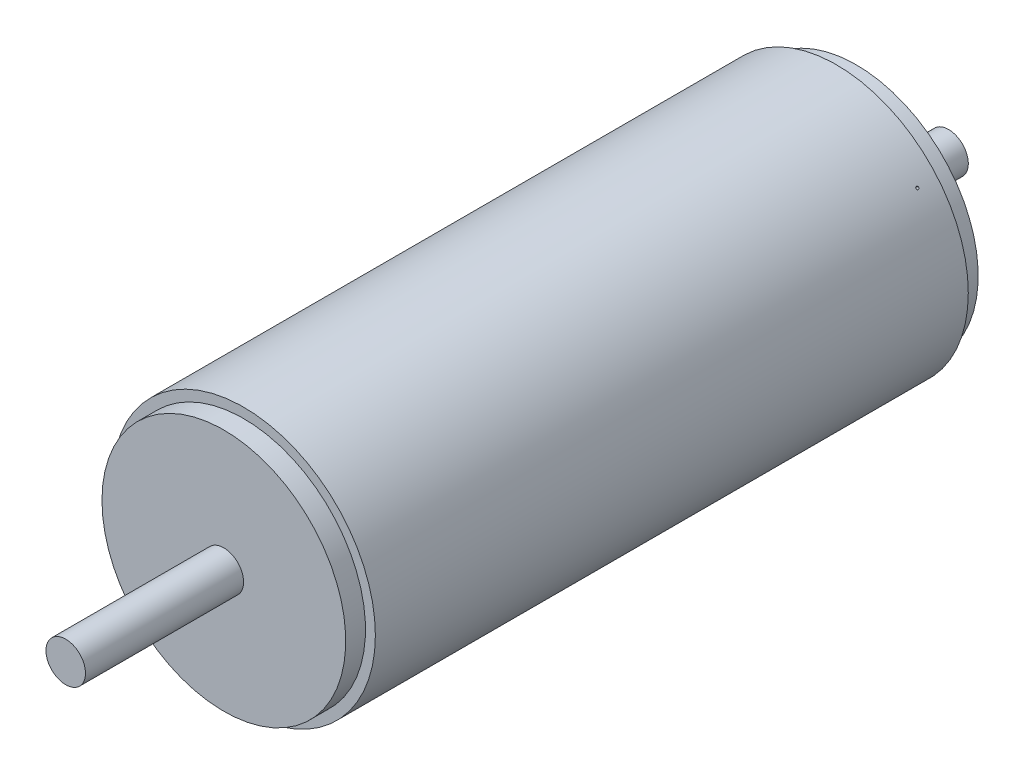
from build123d import *

# Parameters (mm, degrees)
SKETCH1_R           = 100
BOSS_EXTRUDE1_DEPTH = 450
SKETCH2_R           = 92.5
BOSS_EXTRUDE2_DEPTH = 15
SKETCH3_R           = 15
BOSS_EXTRUDE3_DEPTH = 70
BOSS_EXTRUDE4_START = 120
SKETCH4_R           = 15
BOSS_EXTRUDE4_DEPTH = 120
SKETCH5_R           = 1
CUT_EXTRUDE1_DEPTH  = 3


with BuildPart() as part:
    # Sketch1 → Boss-Extrude1 (new body)
    with BuildSketch(Plane.XY):
        Circle(SKETCH1_R)
    extrude(amount=BOSS_EXTRUDE1_DEPTH)

    # Sketch2 → Boss-Extrude2 (add)
    with BuildSketch(Plane(origin=(0, 0, 0), x_dir=(-1, 0, 0), z_dir=(0, 0, -1))):
        Circle(SKETCH2_R)
    boss_extrude2 = extrude(amount=BOSS_EXTRUDE2_DEPTH)

    # Sketch3 → Boss-Extrude3 (add)
    with BuildSketch(Plane(origin=(0, 0, -15), x_dir=(-1, 0, 0), z_dir=(0, 0, -1))):
        Circle(SKETCH3_R)
    extrude(amount=BOSS_EXTRUDE3_DEPTH)

    # Mirror1: Boss-Extrude2 across plane
    add(boss_extrude2.mirror(Plane(origin=(0, 0, 225), x_dir=(1, 0, 0), z_dir=(0, 0, -1))))

    # Sketch4 → Boss-Extrude4 (add)
    with BuildSketch(Plane.XY.offset(465).offset(BOSS_EXTRUDE4_START)):
        Circle(SKETCH4_R)
    extrude(amount=-BOSS_EXTRUDE4_DEPTH)

    # Sketch5 → Cut-Extrude1 (cut)
    with BuildSketch(Plane(origin=(76.297187213, 64.643168421, 0), x_dir=(0, 0, -1), z_dir=(0.7629718721254075, 0.646431684206035, 0))):
        with Locations((-15, 0)):
            Circle(SKETCH5_R)
    extrude(amount=-CUT_EXTRUDE1_DEPTH, mode=Mode.SUBTRACT)


solid = part.part
